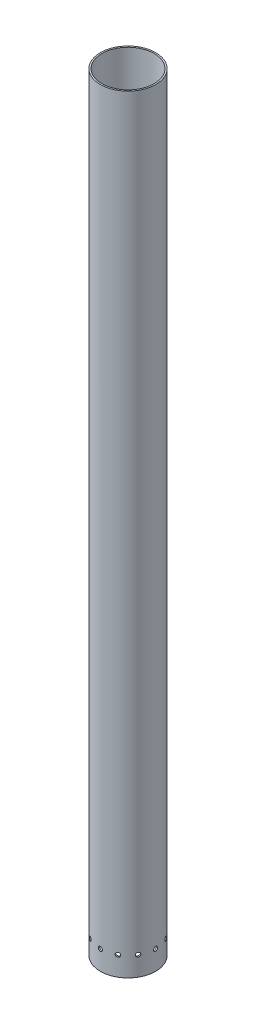
from build123d import *

# Parameters (mm, degrees)
SKETCH1_W         = 1.4732
SKETCH1_H         = 749.3
CIRPATTERN1_COUNT = 12


with BuildPart() as part:
    # Sketch1 → Revolve1 (revolve)
    with BuildSketch(Plane.XY, mode=Mode.PRIVATE) as revolve1_sk:
        with Locations((26.2509, -344.664188343)):
            Rectangle(SKETCH1_W, SKETCH1_H)
    revolve(revolve1_sk.sketch.rotate(Axis((0, 0, 0), (0, 1, 0)), 90), axis=Axis((0, 0, 0), (0, 1, 0)))

    # Sketch3 → #10-32 Tapped Hole1 (revolve, cut)
    with BuildSketch(Plane(origin=(0, -700.264188343, -26.9875), x_dir=(0, 1, 0), z_dir=(1, 0, 0))):
        Polygon((0, 0), (0, 15.183317848), (2.0193, 13.97), (2.0193, 0), align=None)
    f_10_32_tapped_hole1 = revolve(axis=Axis((0, -700.264188343, -33.3375), (0, 0, 1)), mode=Mode.SUBTRACT)

    # CirPattern1: #10-32 Tapped Hole1 ×12 about axis
    cirpattern1_axis = Axis((0, 0, 0), (0, -1, 0))
    for i in range(1, CIRPATTERN1_COUNT):
        add(f_10_32_tapped_hole1.rotate(cirpattern1_axis, i * 360 / CIRPATTERN1_COUNT), mode=Mode.SUBTRACT)


solid = part.part
